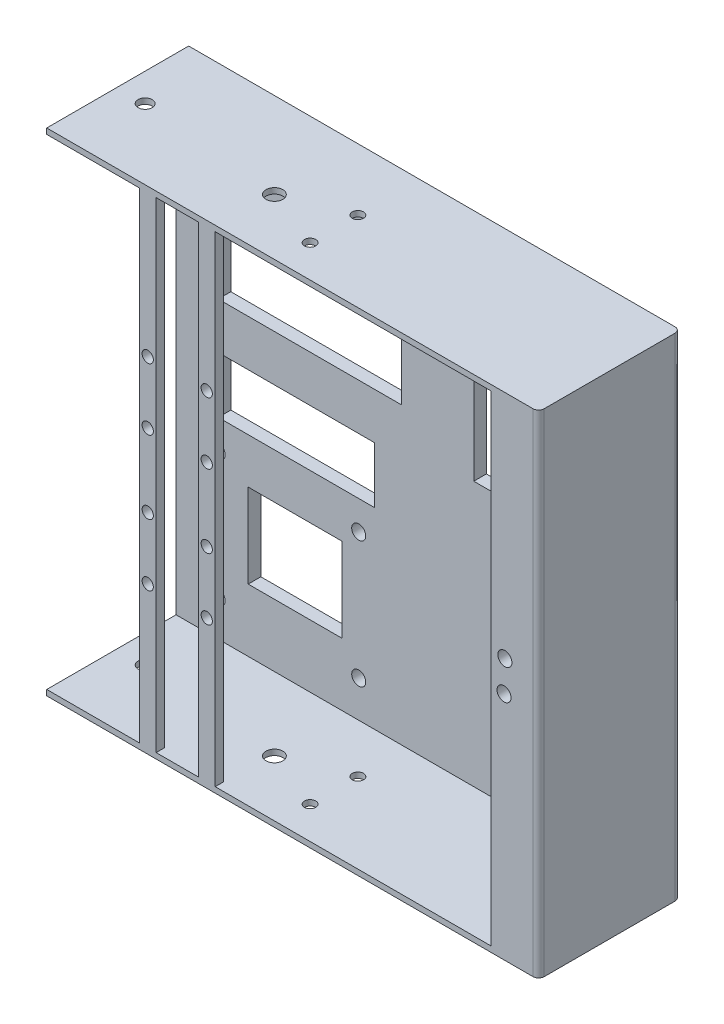
from build123d import *

# Parameters (mm, degrees)
ESQUISSE1_W                   = 175
ESQUISSE1_H                   = 175
BOSS_EXTRU_1_DEPTH            = 4.500081728
BOSS_EXTRU_4_DEPTH            = 46
ESQUISSE12_W                  = 4
ESQUISSE12_H                  = 171
BOSS_EXTRU_5_DEPTH            = 15
ESQUISSE13_R                  = 2.5
ENL_V_MAT_EXTRU_1_DEPTH       = 15
ESQUISSE15_R                  = 2.5
ENL_V_MAT_EXTRU_2_DEPTH       = 253.587130026
ESQUISSE18_W                  = 10
ESQUISSE18_H                  = 155
ENL_V_MAT_EXTRU_3_DEPTH       = 15
ESQUISSE19_R                  = 1.625
ENL_V_MAT_EXTRU_4_DEPTH       = 15
CONG_4_R                      = 2
CONG_5_R                      = 2
CONG_6_R                      = 2
ESQUISSE22_R                  = 2.5
ENL_V_MAT_EXTRU_5_DEPTH       = 10
ESQUISSE27_W                  = 49.077912464
ESQUISSE27_H                  = 68.885759281
ESQUISSE27_W_2                = 65.156972179
ESQUISSE27_H_2                = 37.514528632
ESQUISSE27_W_3                = 33.342624299
ESQUISSE27_H_3                = 29.898225407
ESQUISSE27_W_4                = 70
ESQUISSE27_H_4                = 10
ESQUISSE27_W_5                = 55.665773392
ESQUISSE27_H_5                = 20
ENL_V_MAT_EXTRU_8_DEPTH       = 7.5
BOSS_EXTRU_8_REACH            = 253.206
ESQUISSE28_W                  = 6
ESQUISSE28_H                  = 3
ESQUISSE29_R                  = 2
ENL_V_MAT_EXTRU_9_DEPTH       = 3
ENL_V_MAT_EXTRU_10_DEPTH      = 199
ENL_V_MAT_EXTRU_10_DEPTH_BACK = 10
ESQUISSE30_R                  = 3
ESQUISSE30_R_2                = 2


with BuildPart() as part:
    # Esquisse1 → Boss.-Extru.1 (new body)
    with BuildSketch(Plane.XY):
        with Locations((87.5, 87.5)):
            Rectangle(ESQUISSE1_W, ESQUISSE1_H)
    extrude(amount=BOSS_EXTRU_1_DEPTH)

    # Esquisse9 → Boss.-Extru.4 (add)
    with BuildSketch(Plane.XY.offset(4.500081728)):
        Polygon((0, 2), (0, 0), (172, 0), (175, 0), (175, 4), (175, 146), (175, 175), (173, 175), (0, 175), (0, 173), (173, 173), (173, 2), align=None)
    extrude(amount=BOSS_EXTRU_4_DEPTH)

    # Esquisse12 → Boss.-Extru.5 (add)
    with BuildSketch(Plane.ZY.offset(-173)):
        with Locations((48.500081728, 87.5)):
            Rectangle(ESQUISSE12_W, ESQUISSE12_H)
    extrude(amount=BOSS_EXTRU_5_DEPTH)

    # Esquisse13 → Enlèv. mat.-Extru.1 (cut)
    with BuildSketch(Plane.XY.offset(50.500081728)):
        with Locations((162.695433775, 82.004217199)):
            Circle(ESQUISSE13_R)
        with Locations((163, 93)):
            Circle(ESQUISSE13_R)
    extrude(amount=-ENL_V_MAT_EXTRU_1_DEPTH, mode=Mode.SUBTRACT)

    # Esquisse15 → Enlèv. mat.-Extru.2 (cut, through all)
    with BuildSketch(Plane.XZ):
        with Locations(Location((10, 25.500081728, 0), (0, 0, 270))):
            Circle(ESQUISSE15_R)
    extrude(amount=-ENL_V_MAT_EXTRU_2_DEPTH, mode=Mode.SUBTRACT)

    # Esquisse18 → Enlèv. mat.-Extru.3 (cut)
    with BuildSketch(Plane(origin=(0, 0, 0), x_dir=(-1, 0, 0), z_dir=(0, 0, -1))):
        with Locations((-160, 87.5)):
            Rectangle(ESQUISSE18_W, ESQUISSE18_H)
    extrude(amount=-ENL_V_MAT_EXTRU_3_DEPTH, mode=Mode.SUBTRACT)

    # Esquisse19 → Enlèv. mat.-Extru.4 (cut)
    with BuildSketch(Plane(origin=(0, 0, 0), x_dir=(-1, 0, 0), z_dir=(0, 0, -1))):
        with Locations((-92.63, 150)):
            Circle(ESQUISSE19_R)
        with Locations((-10, 150)):
            Circle(ESQUISSE19_R)
        with Locations((-10, 101.66)):
            Circle(ESQUISSE19_R)
    extrude(amount=-ENL_V_MAT_EXTRU_4_DEPTH, mode=Mode.SUBTRACT)

    # Congé4
    cong_4_edges = [part.edges().sort_by_distance(p)[0] for p in [
        (173, 87.5, 46.500081728),
    ]]
    fillet(cong_4_edges, radius=CONG_4_R)

    # Congé5
    cong_5_edges = [part.edges().sort_by_distance(p)[0] for p in [
        (175, 87.5, 50.500081728),
    ]]
    fillet(cong_5_edges, radius=CONG_5_R)

    # Congé6
    cong_6_edges = [part.edges().sort_by_distance(p)[0] for p in [
        (175, 87.5, 0),
    ]]
    fillet(cong_6_edges, radius=CONG_6_R)

    # Esquisse22 → Enlèv. mat.-Extru.5 (cut)
    with BuildSketch(Plane(origin=(0, 0, 0), x_dir=(-1, 0, 0), z_dir=(0, 0, -1))):
        with Locations((-15, 15)):
            Circle(ESQUISSE22_R)
        with Locations((-65, 15)):
            Circle(ESQUISSE22_R)
        with Locations((-65, 60)):
            Circle(ESQUISSE22_R)
        with Locations((-15, 60)):
            Circle(ESQUISSE22_R)
    extrude(amount=-ENL_V_MAT_EXTRU_5_DEPTH, mode=Mode.SUBTRACT)

    # Esquisse27 → Enlèv. mat.-Extru.8 (cut)
    with BuildSketch(Plane(origin=(0, 0, 0), x_dir=(-1, 0, 0), z_dir=(0, 0, -1))):
        with Locations((-130.461043768, 130.55712036)):
            Rectangle(ESQUISSE27_W, ESQUISSE27_H)
        with Locations((-47.57848609, 125.547945711)):
            Rectangle(ESQUISSE27_W_2, ESQUISSE27_H_2)
        with Locations((-42.34290333, 39.239653333)):
            Rectangle(ESQUISSE27_W_3, ESQUISSE27_H_3)
        with Locations((-50, 164.354328762)):
            Rectangle(ESQUISSE27_W_4, ESQUISSE27_H_4)
        with Locations((-42.832886696, 80.328302815)):
            Rectangle(ESQUISSE27_W_5, ESQUISSE27_H_5)
    extrude(amount=-ENL_V_MAT_EXTRU_8_DEPTH, mode=Mode.SUBTRACT)

    # Esquisse28 → Boss.-Extru.8 (add, up to next)
    with BuildSketch(Plane(origin=(0, 2, 0), x_dir=(1, 0, 0), z_dir=(0, 1, 0)), mode=Mode.PRIVATE) as boss_extru_8_sk1:
        with Locations((35.927740349, -49.000081728)):
            Rectangle(ESQUISSE28_W, ESQUISSE28_H)
    boss_extru_8_tool1 = extrude(boss_extru_8_sk1.sketch, amount=BOSS_EXTRU_8_REACH, mode=Mode.PRIVATE) - part.part
    # Esquisse28 → Boss.-Extru.8 (add, up to next)
    with BuildSketch(Plane(origin=(0, 2, 0), x_dir=(1, 0, 0), z_dir=(0, 1, 0)), mode=Mode.PRIVATE) as boss_extru_8_sk2:
        with Locations((56.927740349, -49.000081728)):
            Rectangle(ESQUISSE28_W, ESQUISSE28_H)
    boss_extru_8_tool2 = extrude(boss_extru_8_sk2.sketch, amount=BOSS_EXTRU_8_REACH, mode=Mode.PRIVATE) - part.part
    add(boss_extru_8_tool1.solids().sort_by_distance((35.92774, 2, 49.000082))[0])
    add(boss_extru_8_tool2.solids().sort_by_distance((56.92774, 2, 49.000082))[0])

    # Esquisse29 → Enlèv. mat.-Extru.9 (cut)
    with BuildSketch(Plane.XY.offset(50.500081728)):
        with Locations((56.927740349, 74.5)):
            Circle(ESQUISSE29_R)
        with Locations((35.927740349, 74.5)):
            Circle(ESQUISSE29_R)
        with Locations((56.927740349, 52.5)):
            Circle(ESQUISSE29_R)
        with Locations((35.927740349, 52.5)):
            Circle(ESQUISSE29_R)
        with Locations((56.927740349, 100.5)):
            Circle(ESQUISSE29_R)
        with Locations((35.927740349, 100.5)):
            Circle(ESQUISSE29_R)
        with Locations((35.927740349, 122.5)):
            Circle(ESQUISSE29_R)
        with Locations((56.927740349, 122.5)):
            Circle(ESQUISSE29_R)
    extrude(amount=-ENL_V_MAT_EXTRU_9_DEPTH, mode=Mode.SUBTRACT)

    # Esquisse30 → Enlèv. mat.-Extru.10 (cut, two sides: drawn at the far end of the back side and taken through both)
    with BuildSketch(Plane(origin=(0, 2, 0), x_dir=(1, 0, 0), z_dir=(0, 1, 0)).offset(-ENL_V_MAT_EXTRU_10_DEPTH_BACK)):
        with Locations((61, -30.500081728)):
            Circle(ESQUISSE30_R)
        with Locations((82.2, -39.000081728)):
            Circle(ESQUISSE30_R_2)
        with Locations((82.2, -22.000081728)):
            Circle(ESQUISSE30_R_2)
    extrude(amount=ENL_V_MAT_EXTRU_10_DEPTH + ENL_V_MAT_EXTRU_10_DEPTH_BACK, mode=Mode.SUBTRACT)


solid = part.part
